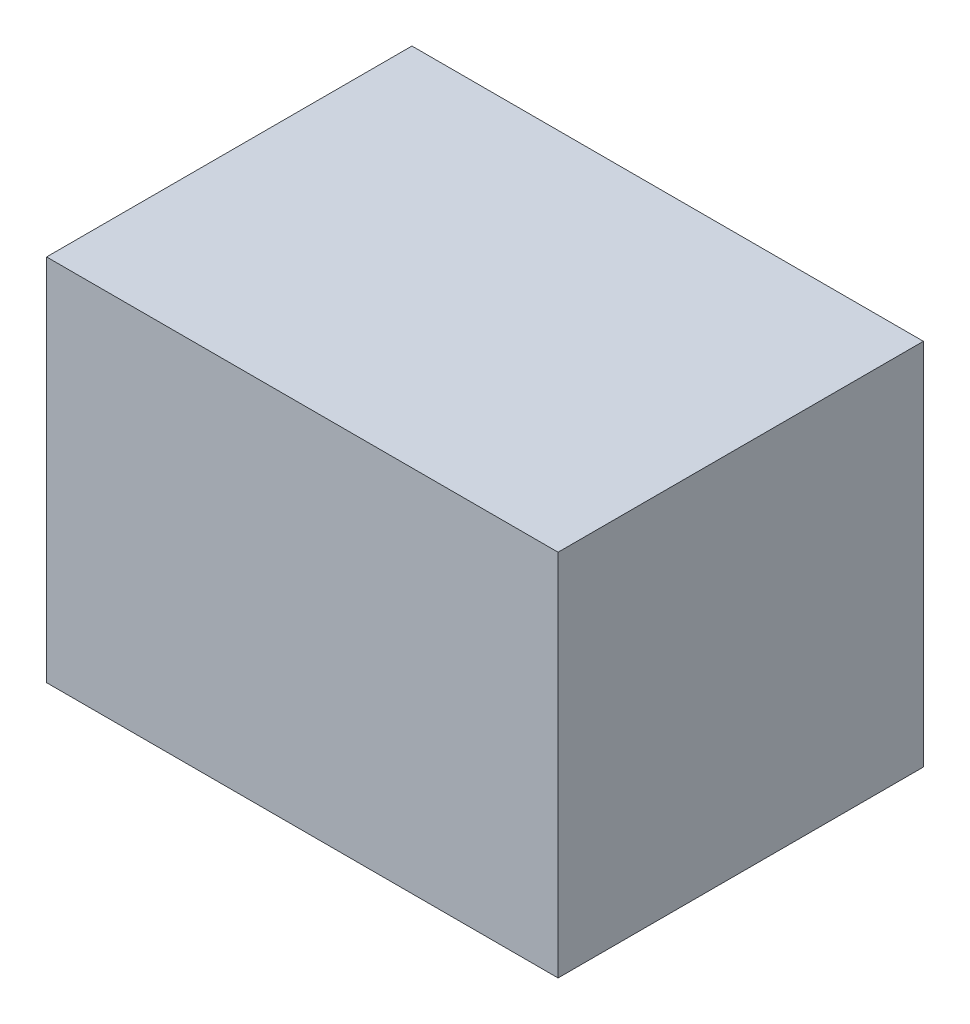
from build123d import *

# Parameters (mm, degrees)
SKETCH2_W           = 105
SKETCH2_H           = 75
BOSS_EXTRUDE1_DEPTH = 75.7


with BuildPart() as part:
    # Sketch2 → Boss-Extrude1 (new body)
    with BuildSketch(Plane(origin=(0, 0, 0), x_dir=(1, 0, 0), z_dir=(0, 1, 0))):
        Rectangle(SKETCH2_W, SKETCH2_H)
    extrude(amount=BOSS_EXTRUDE1_DEPTH)


solid = part.part
